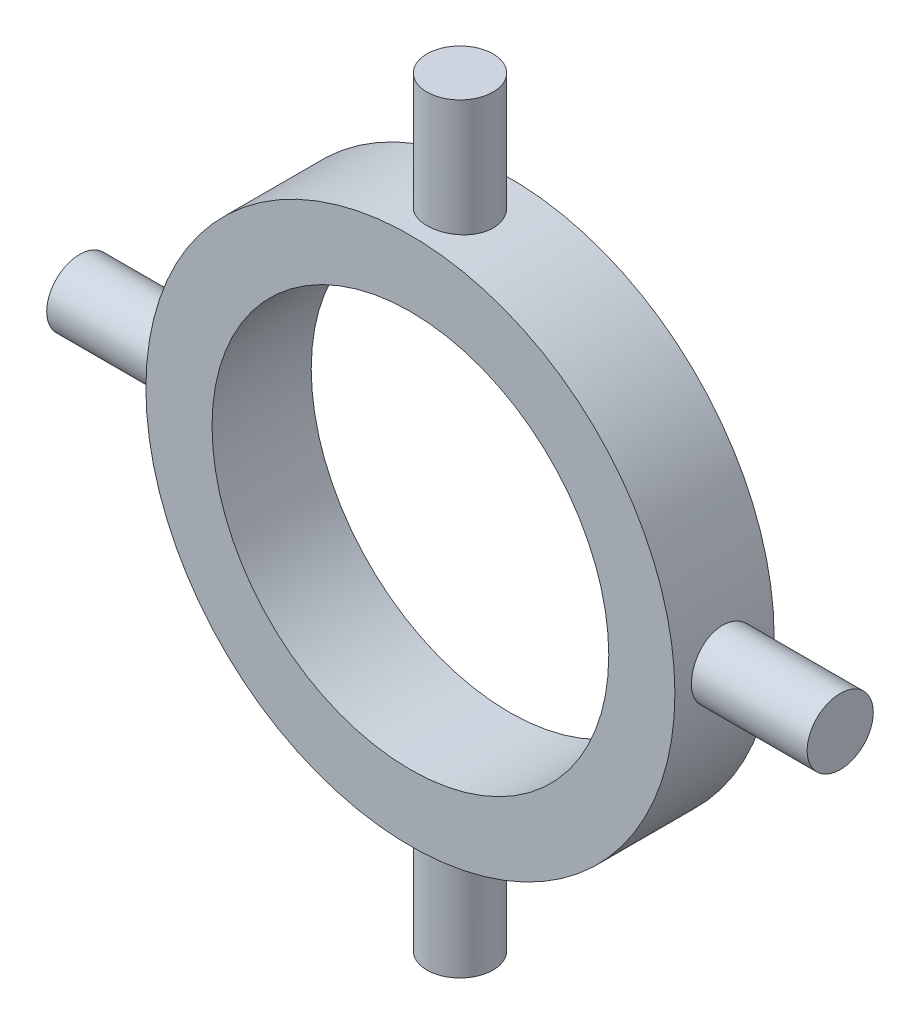
from build123d import *

# Parameters (mm, degrees)
CROQUIS2_R              = 40
CROQUIS2_R_2            = 30
SALIENTE_EXTRUIR1_DEPTH = 7.5
CROQUIS3_R              = 5
SALIENTE_EXTRUIR2_DEPTH = 57.5
CROQUIS4_R              = 5
SALIENTE_EXTRUIR3_DEPTH = 57.5
CORTAR_EXTRUIR1_START   = -115
CROQUIS5_R              = 30
CORTAR_EXTRUIR1_DEPTH   = 115


with BuildPart() as part:
    # Croquis2 → Saliente-Extruir1 (new, symmetric)
    with BuildSketch(Plane.XY):
        Circle(CROQUIS2_R)
        Circle(CROQUIS2_R_2, mode=Mode.SUBTRACT)
    extrude(amount=SALIENTE_EXTRUIR1_DEPTH, both=True)

    # Croquis3 → Saliente-Extruir2 (add, symmetric)
    with BuildSketch(Plane(origin=(0, 0, 0), x_dir=(1, 0, 0), z_dir=(0, 1, 0))):
        with Locations(Location((0, 0, 0), (0, 0, 90))):
            Circle(CROQUIS3_R)
    extrude(amount=SALIENTE_EXTRUIR2_DEPTH, both=True)

    # Croquis4 → Saliente-Extruir3 (add, symmetric)
    with BuildSketch(Plane(origin=(0, 0, 0), x_dir=(0, 0, -1), z_dir=(1, 0, 0))):
        with Locations(Location((0, 0, 0), (0, 0, 180))):
            Circle(CROQUIS4_R)
    extrude(amount=SALIENTE_EXTRUIR3_DEPTH, both=True)

    # Croquis5 → Cortar-Extruir1 (cut)
    with BuildSketch(Plane.XY.offset(7.5).offset(CORTAR_EXTRUIR1_START)):
        Circle(CROQUIS5_R)
    extrude(amount=CORTAR_EXTRUIR1_DEPTH, mode=Mode.SUBTRACT)


solid = part.part
